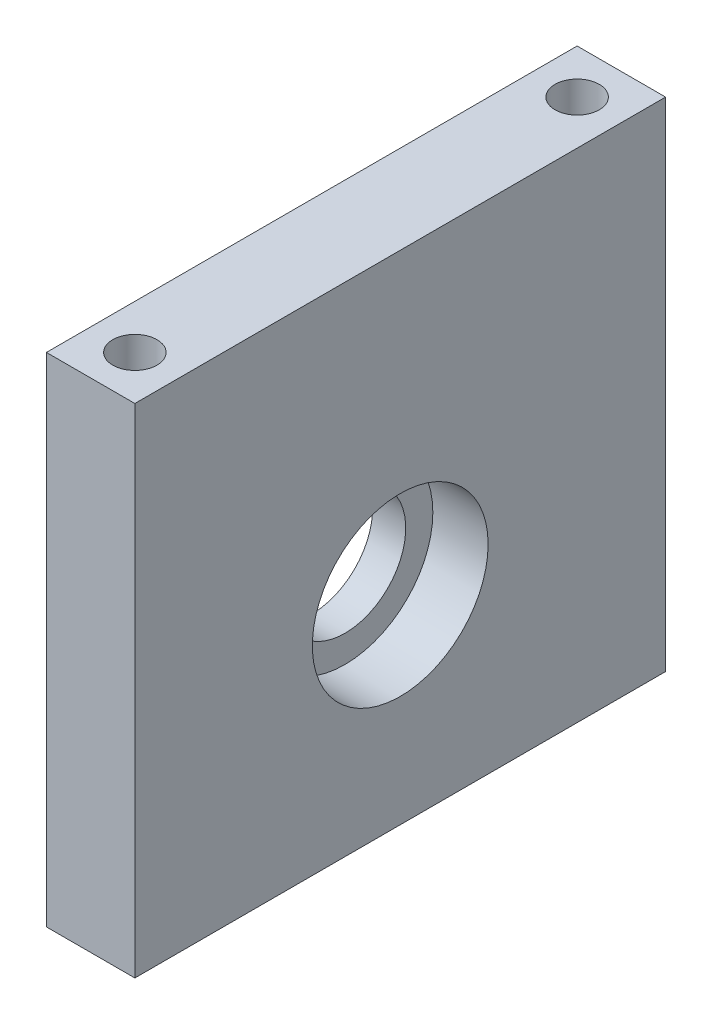
from build123d import *

# Parameters (mm, degrees)
ESQUISSE1_W             = 8
ESQUISSE1_H             = 48
BOSS_EXTRU_1_DEPTH      = 45
ESQUISSE28_R            = 7.95
ENL_V_MAT_EXTRU_1_DEPTH = 10
ESQUISSE29_R            = 8.1
ESQUISSE29_R_2          = 5.5
BOSS_EXTRU_2_DEPTH      = 3
ESQUISSE30_R            = 2
ENL_V_MAT_EXTRU_2_DEPTH = 15
ENL_V_START             = -15
ESQUISSE31_R            = 2
ENL_V_MAT_EXTRU_3_DEPTH = 15


with BuildPart() as part:
    # Esquisse1 → Boss.-Extru.1 (new body)
    with BuildSketch(Plane(origin=(0, 0, 0), x_dir=(1, 0, 0), z_dir=(0, 1, 0))):
        with Locations((4, 24)):
            Rectangle(ESQUISSE1_W, ESQUISSE1_H)
    extrude(amount=BOSS_EXTRU_1_DEPTH)

    # Esquisse28 → Enlèv. mat.-Extru.1 (cut)
    with BuildSketch(Plane(origin=(8, 0, 0), x_dir=(0, 0, -1), z_dir=(1, 0, 0))):
        with Locations((24, 18)):
            Circle(ESQUISSE28_R)
    extrude(amount=-ENL_V_MAT_EXTRU_1_DEPTH, mode=Mode.SUBTRACT)

    # Esquisse29 → Boss.-Extru.2 (add)
    with BuildSketch(Plane.ZY):
        with Locations((-24, 18)):
            Circle(ESQUISSE29_R)
        with Locations((-24, 18)):
            Circle(ESQUISSE29_R_2, mode=Mode.SUBTRACT)
    extrude(amount=-BOSS_EXTRU_2_DEPTH)

    # Esquisse30 → Enlèv. mat.-Extru.2 (cut)
    with BuildSketch(Plane.XZ):
        with Locations((4, -44)):
            Circle(ESQUISSE30_R)
        with Locations((4, -4)):
            Circle(ESQUISSE30_R)
    extrude(amount=-ENL_V_MAT_EXTRU_2_DEPTH, mode=Mode.SUBTRACT)

    # Esquisse31 → Enlèv. mat.-Extru.3 (cut)
    with BuildSketch(Plane(origin=(0, 45, 0), x_dir=(1, 0, 0), z_dir=(0, 1, 0)).offset(ENL_V_START)):
        with Locations((4, 44)):
            Circle(ESQUISSE31_R)
        with Locations((4, 4)):
            Circle(ESQUISSE31_R)
    extrude(amount=ENL_V_MAT_EXTRU_3_DEPTH, mode=Mode.SUBTRACT)


solid = part.part
